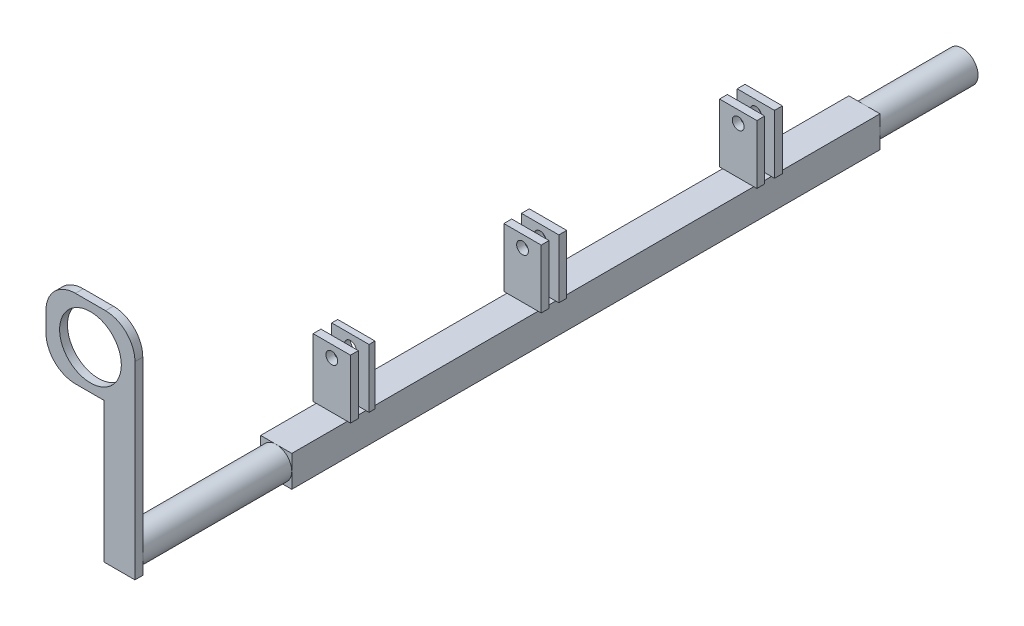
from build123d import *

# Parameters (mm, degrees)
CROQUIS2_W              = 15.88
CROQUIS2_H              = 15.88
SALIENTE_EXTRUIR1_DEPTH = 300
CROQUIS3_R              = 7.94
SALIENTE_EXTRUIR2_DEPTH = 50
SALIENTE_EXTRUIR3_START = 50
CROQUIS5_R              = 7.94
SALIENTE_EXTRUIR3_DEPTH = 50
CROQUIS6_W              = 19.05
CROQUIS6_H              = 4
CROQUIS6_H_2            = 3.052323646
SALIENTE_EXTRUIR4_DEPTH = 30
CORTAR_EXTRUIR1_REACH   = 303.171
CROQUIS7_R              = 3
CROQUIS8_R              = 7.94
SALIENTE_EXTRUIR5_DEPTH = 30
CROQUIS9_R              = 15.735705631
SALIENTE_EXTRUIR6_DEPTH = 4


with BuildPart() as part:
    # Croquis2 → Saliente-Extruir1 (new body)
    with BuildSketch(Plane.XY):
        Rectangle(CROQUIS2_W, CROQUIS2_H)
    extrude(amount=SALIENTE_EXTRUIR1_DEPTH)

    # Croquis3 → Saliente-Extruir2 (add)
    with BuildSketch(Plane.XY.offset(300)):
        Circle(CROQUIS3_R)
    extrude(amount=SALIENTE_EXTRUIR2_DEPTH)

    # Croquis5 → Saliente-Extruir3 (add)
    with BuildSketch(Plane(origin=(0, 0, 0), x_dir=(-1, 0, 0), z_dir=(0, 0, -1)).offset(SALIENTE_EXTRUIR3_START)):
        with Locations(Location((0, 0, 0), (0, 0, 180))):
            Circle(CROQUIS5_R)
    extrude(amount=-SALIENTE_EXTRUIR3_DEPTH)

    # Croquis6 → Saliente-Extruir4 (add)
    with BuildSketch(Plane(origin=(0, 7.94, 0), x_dir=(1, 0, 0), z_dir=(0, 1, 0))):
        with Locations((0, -269.65)):
            Rectangle(CROQUIS6_W, CROQUIS6_H)
        with Locations((0, -260.65)):
            Rectangle(CROQUIS6_W, CROQUIS6_H_2)
        with Locations((0, -172.38)):
            Rectangle(CROQUIS6_W, CROQUIS6_H)
        with Locations((0, -163.38)):
            Rectangle(CROQUIS6_W, CROQUIS6_H)
        with Locations((0, -62.38)):
            Rectangle(CROQUIS6_W, CROQUIS6_H)
        with Locations((0, -53.38)):
            Rectangle(CROQUIS6_W, CROQUIS6_H)
    extrude(amount=SALIENTE_EXTRUIR4_DEPTH)

    # Cortar-Extruir1: up to this face of the body (flat: up to its plane)
    cortar_extruir1_end = Plane(part.part.faces().sort_by_distance((0, 22.94, 271.65))[0])
    # Croquis7 → Cortar-Extruir1 (cut, up to the picked face)
    with BuildSketch(Plane(origin=(0, 0, 51.38), x_dir=(-1, 0, 0), z_dir=(0, 0, -1)), mode=Mode.PRIVATE) as cortar_extruir1_sk1:
        with Locations((0, 31.94)):
            Circle(CROQUIS7_R)
    cortar_extruir1_tool1 = split(extrude(cortar_extruir1_sk1.sketch, amount=-CORTAR_EXTRUIR1_REACH, mode=Mode.PRIVATE), bisect_by=cortar_extruir1_end, keep=Keep.BOTH, mode=Mode.PRIVATE)
    add(cortar_extruir1_tool1.solids().sort_by(Axis((0, 31.94, 51.38), (0, 0, 1)))[0], mode=Mode.SUBTRACT)

    # Croquis8 → Saliente-Extruir5 (add)
    with BuildSketch(Plane.XY.offset(350)):
        Circle(CROQUIS8_R)
    extrude(amount=SALIENTE_EXTRUIR5_DEPTH)

    # Croquis9 → Saliente-Extruir6 (add)
    with BuildSketch(Plane.XY.offset(380)):
        with BuildLine():
            Line((-7.94, 7.94), (-7.94, 27.049213062))
            Line((-7.94, 27.049213062), (-7.94, 63.465360978))
            Line((-7.94, 63.465360978), (-22.419294846, 63.465360978))
            ThreePointArc((-22.419294846, 63.465360978), (-33.025896564, 67.85875926), (-37.419294846, 78.465360978))
            Line((-37.419294846, 78.465360978), (-37.419294846, 88.478483412))
            ThreePointArc((-37.419294846, 88.478483412), (-33.025896564, 99.085085129), (-22.419294846, 103.478483412))
            Line((-22.419294846, 103.478483412), (-7.06, 103.478483412))
            ThreePointArc((-7.06, 103.478483412), (3.546601718, 99.085085129), (7.94, 88.478483412))
            Line((7.94, 88.478483412), (7.94, 63.465360978))
            Line((7.94, 63.465360978), (7.94, 7.94))
            Line((7.94, 7.94), (7.94, -7.94))
            Line((7.94, -7.94), (-7.94, -7.94))
            Line((-7.94, -7.94), (-7.94, 7.94))
        make_face()
        with Locations((-14.739647423, 83.471922195)):
            Circle(CROQUIS9_R, mode=Mode.SUBTRACT)
    extrude(amount=-SALIENTE_EXTRUIR6_DEPTH)


solid = part.part
